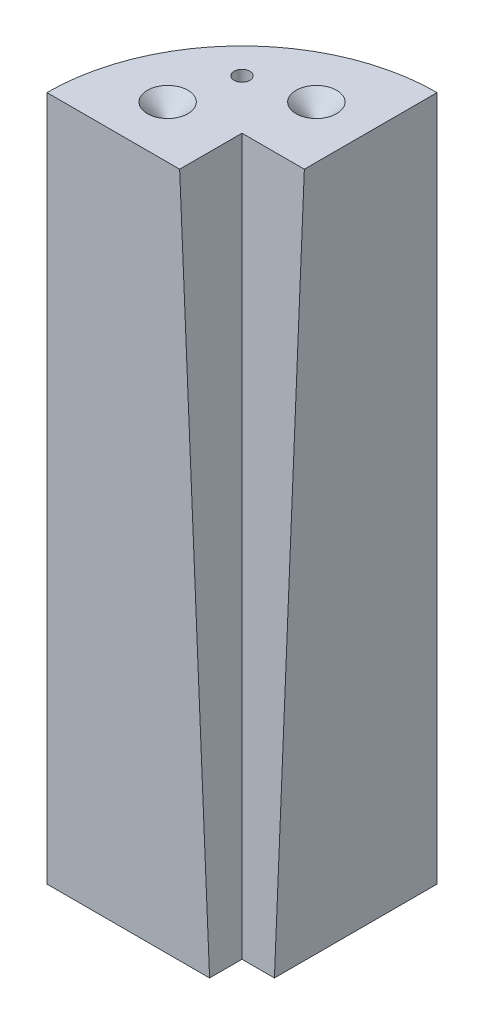
from build123d import *

# Parameters (mm, degrees)
SKETCH1_R                    = 46.99
BOSS_EXTRUDE1_DEPTH          = 330.2
SKETCH2_W                    = 44.45
SKETCH2_H                    = 44.45
CUT_EXTRUDE1_DEPTH           = 330.2
CUT_EXTRUDE1_DRAFT           = -2.5
CUT_EXTRUDE2_START           = -330.2
SKETCH3_R                    = 1.905
CUT_EXTRUDE2_DEPTH           = 330.2
CUT_EXTRUDE4_START           = -165.1
CUT_EXTRUDE4_DEPTH           = 165.1
SKETCH8_R                    = 4.8895
CUT_EXTRUDE5_DEPTH           = 4.7879
CUT_EXTRUDE5_DRAFT           = -45
CUT_EXTRUDE5_PROFILE_2_DEPTH = 4.7879
CUT_EXTRUDE5_PROFILE_2_DRAFT = -45


with BuildPart() as part:
    # Sketch1 → Boss-Extrude1 (new body)
    with BuildSketch(Plane(origin=(0, 0, 0), x_dir=(1, 0, 0), z_dir=(0, 1, 0))):
        with Locations(Location((0, 0, 0), (0, 0, 270))):
            Circle(SKETCH1_R)
    extrude(amount=BOSS_EXTRUDE1_DEPTH)


with BuildPart() as cut_extrude1_tool:
    # Sketch2 → Cut-Extrude1 (with draft: the straight prism first)
    with BuildSketch(Plane(origin=(0, 330.2, 0), x_dir=(1, 0, 0), z_dir=(0, 1, 0))):
        Rectangle(SKETCH2_W, SKETCH2_H)
    extrude(amount=-CUT_EXTRUDE1_DEPTH)
    # Cut-Extrude1: the draft: its side faces are tilted about the plane it starts from
    cut_extrude1_sides = [cut_extrude1_tool.faces().sort_by_distance(p)[0] for p in [
        (-22.225, 165.1, 0),
        (0, 165.1, 22.225),
        (22.225, 165.1, 0),
        (0, 165.1, -22.225),
    ]]
    draft(cut_extrude1_sides, Plane(origin=(0, 330.2, 0), x_dir=(1, 0, 0), z_dir=(0, 1, 0)), CUT_EXTRUDE1_DRAFT)


with BuildPart() as part_1:
    add(part.part)

    # Cut-Extrude1: cut by cut_extrude1_tool
    add(cut_extrude1_tool.part, mode=Mode.SUBTRACT)

    # Sketch3 → Cut-Extrude2 (cut)
    with BuildSketch(Plane(origin=(0, 330.2, 0), x_dir=(1, 0, 0), z_dir=(0, 1, 0)).offset(CUT_EXTRUDE2_START)):
        with Locations(Location((-26.9875, 26.9875, 0), (0, 0, 270))):
            Circle(SKETCH3_R)
        with BuildLine():
            Line((0, 12.7), (0, 46.99))
            ThreePointArc((0, 46.99), (33.226947648, -33.226947648), (-46.99, 0))
            Line((-46.99, 0), (-12.7, 0))
            Line((-12.7, 0), (0, 0))
            Line((0, 0), (0, 12.7))
        make_face()
    extrude(amount=CUT_EXTRUDE2_DEPTH, mode=Mode.SUBTRACT)

    # Sketch7 → Cut-Extrude4 (cut)
    with BuildSketch(Plane(origin=(0, 330.2, 0), x_dir=(1, 0, 0), z_dir=(0, 1, 0)).offset(CUT_EXTRUDE4_START)):
        with BuildLine():
            Line((0, 46.99), (0, 0))
            Line((0, 0), (-46.99, 0))
            ThreePointArc((-46.99, 0), (-33.226947648, 33.226947648), (0, 46.99))
        make_face()
    extrude(amount=CUT_EXTRUDE4_DEPTH, mode=Mode.SUBTRACT)


with BuildPart() as cut_extrude5_tool:
    # Sketch8 → Cut-Extrude5 (with draft: the straight prism first)
    with BuildSketch(Plane(origin=(0, 165.1, 0), x_dir=(1, 0, 0), z_dir=(0, 1, 0))):
        with Locations((-12.573, 30.48)):
            Circle(SKETCH8_R)
    extrude(amount=-CUT_EXTRUDE5_DEPTH)
    # Cut-Extrude5: the draft: its side faces are tilted about the plane it starts from
    cut_extrude5_sides = [cut_extrude5_tool.faces().sort_by_distance(p)[0] for p in [
        (-17.4625, 162.70605, -30.48),
    ]]
    draft(cut_extrude5_sides, Plane(origin=(0, 165.1, 0), x_dir=(1, 0, 0), z_dir=(0, 1, 0)), CUT_EXTRUDE5_DRAFT)


with BuildPart() as part_2:
    add(part_1.part)

    # Cut-Extrude5: cut by cut_extrude5_tool
    add(cut_extrude5_tool.part, mode=Mode.SUBTRACT)


with BuildPart() as cut_extrude5_profile_2_tool:
    # Sketch8 → Cut-Extrude5 profile 2 (with draft: the straight prism first)
    with BuildSketch(Plane(origin=(0, 165.1, 0), x_dir=(1, 0, 0), z_dir=(0, 1, 0))):
        with Locations((-30.48, 12.573)):
            Circle(SKETCH8_R)
    extrude(amount=-CUT_EXTRUDE5_PROFILE_2_DEPTH)
    # Cut-Extrude5 profile 2: the draft: its side faces are tilted about the plane it starts from
    cut_extrude5_profile_2_sides = [cut_extrude5_profile_2_tool.faces().sort_by_distance(p)[0] for p in [
        (-35.3695, 162.70605, -12.573),
    ]]
    draft(cut_extrude5_profile_2_sides, Plane(origin=(0, 165.1, 0), x_dir=(1, 0, 0), z_dir=(0, 1, 0)), CUT_EXTRUDE5_PROFILE_2_DRAFT)


with BuildPart() as part_3:
    add(part_2.part)

    # Cut-Extrude5 profile 2: cut by cut_extrude5_profile_2_tool
    add(cut_extrude5_profile_2_tool.part, mode=Mode.SUBTRACT)


solid = part_3.part
